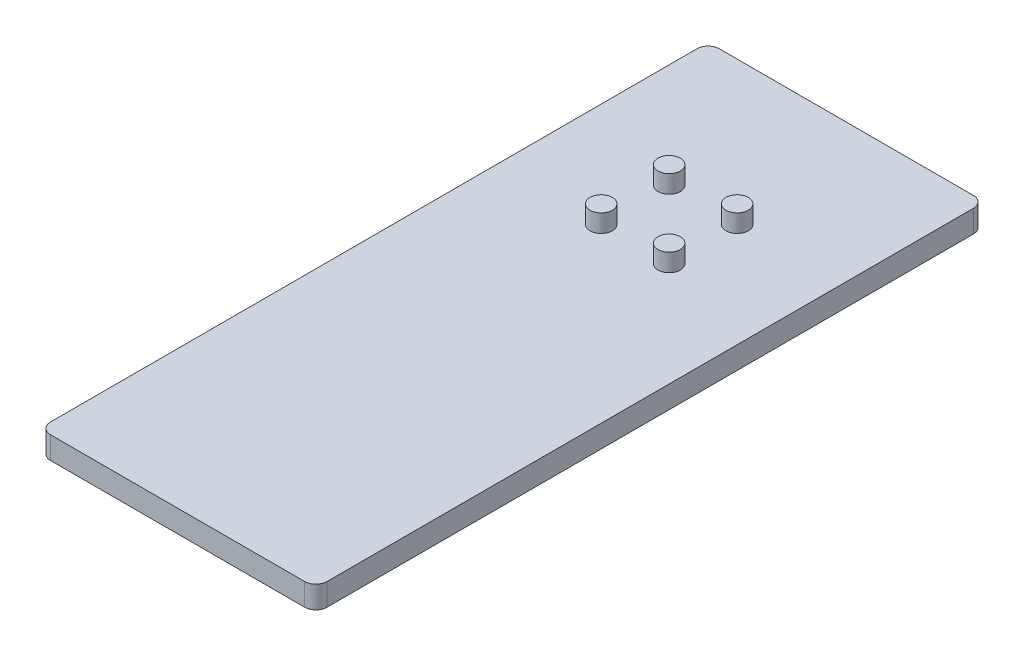
from build123d import *

# Parameters (mm, degrees)
SKETCH1_W           = 62
SKETCH1_H           = 150
BOSS_EXTRUDE1_DEPTH = 5
FILLET1_R           = 2.5
SKETCH3_R           = 2.5
BOSS_EXTRUDE2_DEPTH = 4


with BuildPart() as part:
    # Sketch1 → Boss-Extrude1 (new body)
    with BuildSketch(Plane(origin=(0, 0, 0), x_dir=(1, 0, 0), z_dir=(0, 1, 0))):
        Rectangle(SKETCH1_W, SKETCH1_H)
    extrude(amount=BOSS_EXTRUDE1_DEPTH)

    # Fillet1
    fillet1_edges = [part.edges().sort_by_distance(p)[0] for p in [
        (31, 2.5, 75),
        (-31, 2.5, 75),
        (-31, 2.5, -75),
        (31, 2.5, -75),
    ]]
    fillet(fillet1_edges, radius=FILLET1_R)

    # Sketch3 → Boss-Extrude2 (add)
    with BuildSketch(Plane(origin=(0, 5, 0), x_dir=(1, 0, 0), z_dir=(0, 1, 0))):
        with Locations(Location((-7.625, 42.875, 0), (0, 0, 270))):
            Circle(SKETCH3_R)
        with Locations(Location((7.625, 42.875, 0), (0, 0, 270))):
            Circle(SKETCH3_R)
        with Locations(Location((7.625, 27.625, 0), (0, 0, 270))):
            Circle(SKETCH3_R)
        with Locations(Location((-7.625, 27.625, 0), (0, 0, 270))):
            Circle(SKETCH3_R)
    extrude(amount=BOSS_EXTRUDE2_DEPTH)


solid = part.part
